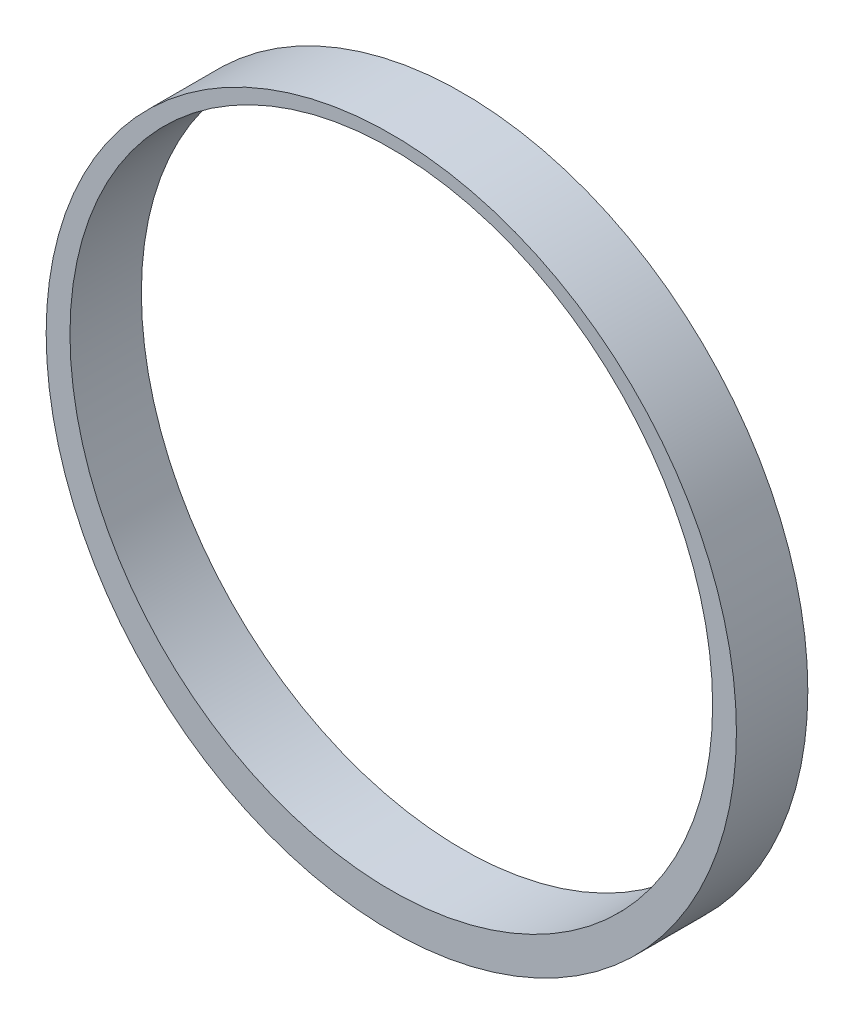
from build123d import *

# Parameters (mm, degrees)
SKETCH1_R           = 58
BOSS_EXTRUDE2_DEPTH = 12
SKETCH5_R           = 54
CUT_EXTRUDE1_DEPTH  = 23


with BuildPart() as part:
    # Sketch1 → Boss-Extrude2 (new body)
    with BuildSketch(Plane.XY):
        with Locations((0, -1.896585201)):
            Circle(SKETCH1_R)
    extrude(amount=BOSS_EXTRUDE2_DEPTH)

    # Sketch5 → Cut-Extrude1 (cut)
    with BuildSketch(Plane.XY):
        Circle(SKETCH5_R)
    extrude(amount=CUT_EXTRUDE1_DEPTH, mode=Mode.SUBTRACT)


solid = part.part
